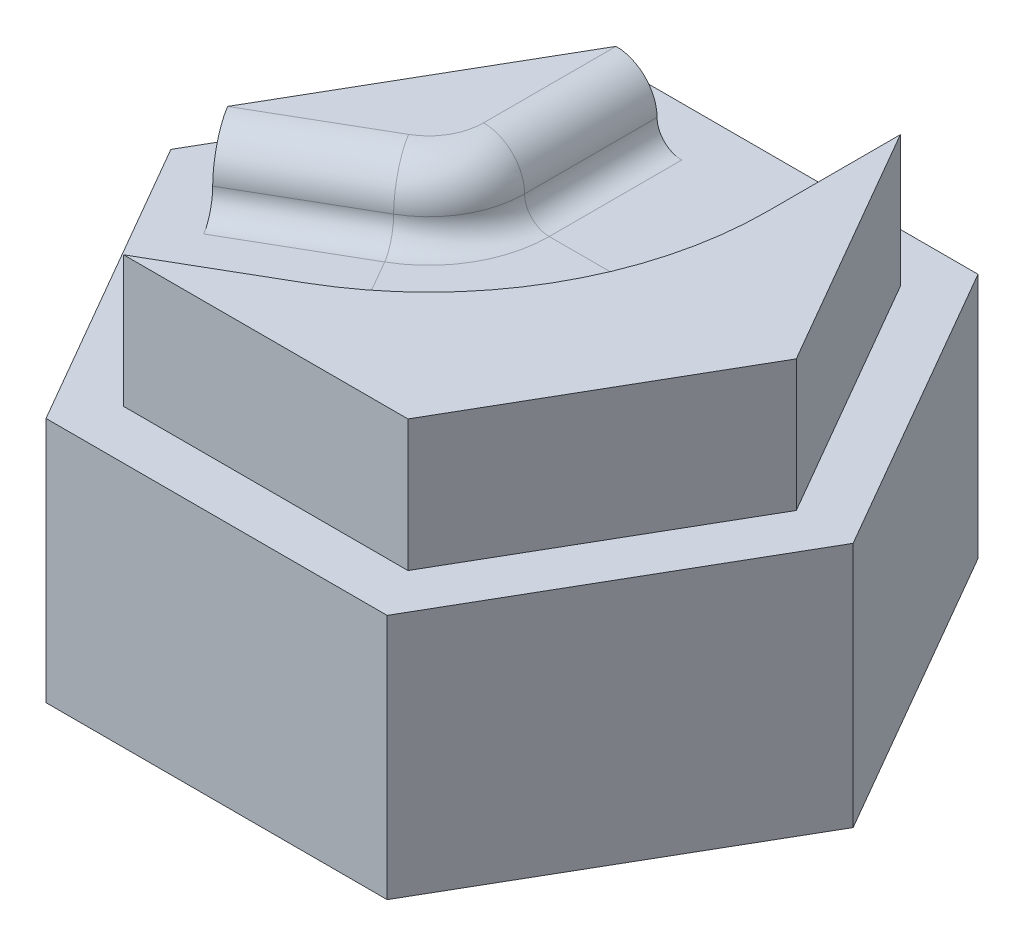
from build123d import *

# Parameters (mm, degrees)
BOSS_EXTRUDE1_DEPTH = 7.5
CUT_EXTRUDE1_DEPTH  = 2
BOSS_EXTRUDE2_DEPTH = 2
BOSS_EXTRUDE3_DEPTH = 2


with BuildPart() as part:
    # Sketch1 → Boss-Extrude1 (new body)
    with BuildSketch(Plane(origin=(0, 0, 0), x_dir=(1, 0, 0), z_dir=(0, 1, 0))):
        Polygon((5.196152423, -9), (10.392304845, 0), (5.196152423, 9), (-5.196152423, 9), (-10.392304845, 0), (-5.196152423, -9), align=None)
    extrude(amount=BOSS_EXTRUDE1_DEPTH)

    # Sketch1<3> → Cut-Extrude1 (cut)
    with BuildSketch(Plane(origin=(0, 0, 0), x_dir=(1, 0, 0), z_dir=(0, 1, 0))):
        Polygon((4.330127019, -7.5), (8.660254038, 0), (4.330127019, 7.5), (-4.330127019, 7.5), (-8.660254038, 0), (-4.330127019, -7.5), align=None)
    extrude(amount=CUT_EXTRUDE1_DEPTH, mode=Mode.SUBTRACT)

    # Sketch4 → Boss-Extrude2 (add)
    with BuildSketch(Plane(origin=(0, 7.5, 0), x_dir=(1, 0, 0), z_dir=(0, 1, 0))):
        Polygon((8.660254038, 0), (4.330127019, 7.5), (-4.330127019, 7.5), (-8.660254038, 0), (-4.330127019, -7.5), (4.330127019, -7.5), align=None)
    extrude(amount=BOSS_EXTRUDE2_DEPTH)

    # Cut-Sweep3: sweep along a path in Sketch7
    with BuildLine(Plane(origin=(0, 9.5, 0), x_dir=(1, 0, 0), z_dir=(0, 1, 0))) as cut_sweep3_path:
        Line((-6.495190528, -3.75), (-3, -1.732050808))
        ThreePointArc((-3, -1.732050808), (-0.803847577, 0.464101615), (0, 3.464101615))
        Line((0, 3.464101615), (0, 7.5))
    # Sketch5 → Cut-Sweep3 (sweep, cut)
    with BuildSketch(Plane(origin=(-6.495190528, 0, 3.75), x_dir=(0.5000000000000006, 0, 0.8660254037844384), z_dir=(-0.8660254037844384, 0, 0.5000000000000006))):
        with BuildLine():
            Line((-4.330127019, 9.5), (4.330127019, 9.5))
            ThreePointArc((4.330127019, 9.5), (3.446243542, 9.133883476), (3.080127019, 8.25))
            ThreePointArc((3.080127019, 8.25), (2.860457105, 7.719669914), (2.330127019, 7.5))
            Line((2.330127019, 7.5), (-2.330127019, 7.5))
            ThreePointArc((-2.330127019, 7.5), (-2.860457105, 7.719669914), (-3.080127019, 8.25))
            ThreePointArc((-3.080127019, 8.25), (-3.446243542, 9.133883476), (-4.330127019, 9.5))
        make_face()
    sweep(path=cut_sweep3_path.line, mode=Mode.SUBTRACT)

    # Sketch8 → Boss-Extrude3 (add)
    with BuildSketch(Plane(origin=(0, 9.5, 0), x_dir=(1, 0, 0), z_dir=(0, 1, 0))):
        with BuildLine():
            Line((-0.834936491, -5.482050808), (-4.330127019, -7.5))
            Line((-4.330127019, -7.5), (4.330127019, -7.5))
            Line((4.330127019, -7.5), (8.660254038, 0))
            Line((8.660254038, 0), (4.330127019, 7.5))
            Line((4.330127019, 7.5), (4.330127019, 3.464101615))
            ThreePointArc((4.330127019, 3.464101615), (2.946152423, -1.700961894), (-0.834936491, -5.482050808))
        make_face()
    extrude(amount=BOSS_EXTRUDE3_DEPTH)


solid = part.part
